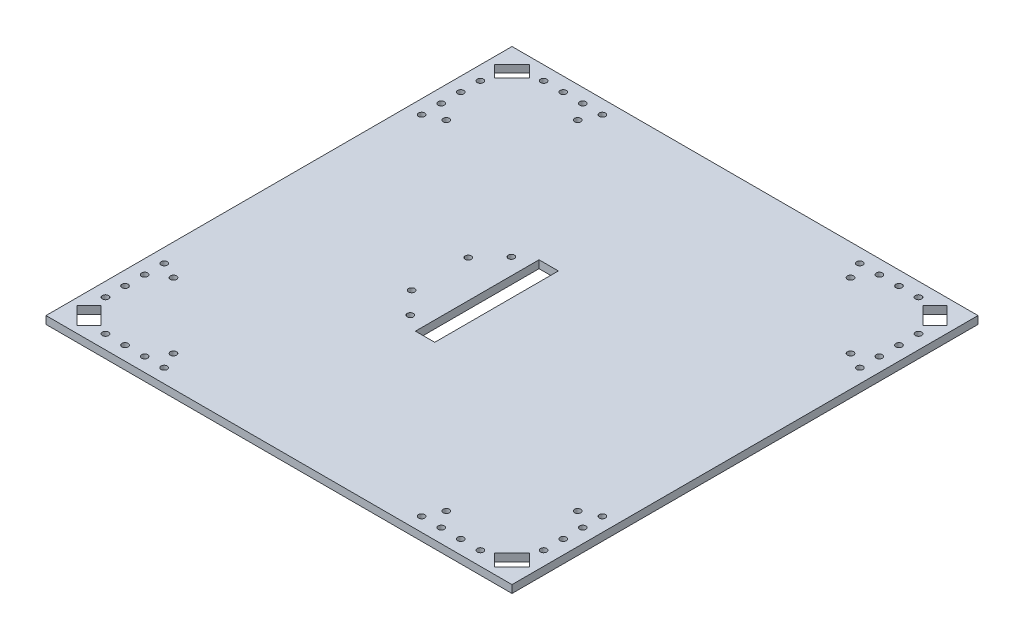
from build123d import *

# Parameters (mm, degrees)
SKETCH1_W               = 301.625
SKETCH1_H               = 301.625
BOSS_EXTRUDE1_DEPTH     = 5
CUT_EXTRUDE1_DEPTH      = 10
SKETCH4_W               = 12.5
SKETCH4_H               = 80
CUT_EXTRUDE3_DEPTH      = 214.33968293
SKETCH5_R               = 2
CUT_EXTRUDE4_DEPTH      = 10
MIRROR2_COPY_1_SKETCH_R = 2
MIRROR2_COPY_1_DEPTH    = 10
MIRROR3_COPY_1_SKETCH_R = 2
MIRROR3_COPY_1_DEPTH    = 10
MIRROR3_COPY_2_SKETCH_R = 2
MIRROR3_COPY_2_DEPTH    = 10
MIRROR3_COPY_3_SKETCH_R = 2
MIRROR3_COPY_3_DEPTH    = 10
SKETCH6_R               = 2
CUT_EXTRUDE5_DEPTH      = 214.33968293


with BuildPart() as part:
    # Sketch1 → Boss-Extrude1 (new body)
    with BuildSketch(Plane(origin=(0, 0, 0), x_dir=(1, 0, 0), z_dir=(0, 1, 0))):
        Rectangle(SKETCH1_W, SKETCH1_H)
    extrude(amount=BOSS_EXTRUDE1_DEPTH)

    # Sketch2 → Cut-Extrude1 (cut)
    with BuildSketch(Plane.XZ):
        Polygon((127.420616908, 138.734325407), (138.734325407, 127.420616908), (146.5125, 135.198791501), (135.198791501, 146.5125), align=None)
        Polygon((146.5125, -135.198791501), (138.734325407, -127.420616908), (127.420616908, -138.734325407), (135.198791501, -146.5125), align=None)
        Polygon((-135.198791501, -146.5125), (-127.420616908, -138.734325407), (-138.734325407, -127.420616908), (-146.5125, -135.198791501), align=None)
        Polygon((-146.5125, 135.198791501), (-138.734325407, 127.420616908), (-127.420616908, 138.734325407), (-135.198791501, 146.5125), align=None)
    extrude(amount=-CUT_EXTRUDE1_DEPTH, mode=Mode.SUBTRACT)

    # Sketch4 → Cut-Extrude3 (cut, through all)
    with BuildSketch(Plane(origin=(0, 5, 0), x_dir=(1, 0, 0), z_dir=(0, 1, 0))):
        with Locations((-16.25, 0)):
            Rectangle(SKETCH4_W, SKETCH4_H)
    extrude(amount=-CUT_EXTRUDE3_DEPTH, mode=Mode.SUBTRACT)

    # Sketch5 → Cut-Extrude4 (cut)
    with BuildSketch(Plane(origin=(0, 5, 0), x_dir=(1, 0, 0), z_dir=(0, 1, 0))):
        with Locations(Location((-130.8125, 88.3125, 0), (0, 0, 270))):
            Circle(SKETCH5_R)
        with Locations(Location((-141.8125, 95.979166667, 0), (0, 0, 270))):
            Circle(SKETCH5_R)
        with Locations(Location((-141.8125, 83.3125, 0), (0, 0, 270))):
            Circle(SKETCH5_R)
        with Locations(Location((-141.8125, 108.645833333, 0), (0, 0, 270))):
            Circle(SKETCH5_R)
        with Locations(Location((-141.8125, 121.3125, 0), (0, 0, 270))):
            Circle(SKETCH5_R)
    cut_extrude4 = extrude(amount=-CUT_EXTRUDE4_DEPTH, mode=Mode.SUBTRACT)

    # Mirror1: Cut-Extrude4 across plane
    add(cut_extrude4.mirror(Plane(origin=(0, 0, 0), x_dir=(0.7071067811865476, 0, 0.7071067811865476), z_dir=(-0.7071067811865477, 0, 0.7071067811865475))), mode=Mode.SUBTRACT)

    # Mirror2: Cut-Extrude4 across plane
    add(cut_extrude4.mirror(Plane.XY), mode=Mode.SUBTRACT)

    # Mirror2 copy 1 sketch → Mirror2 copy 1 (cut)
    with BuildSketch(Plane(origin=(0, 5, 0), x_dir=(0, 0, -1), z_dir=(0, 1, 0))):
        with Locations(Location((-130.8125, 88.3125, 0), (0, 0, 270))):
            Circle(MIRROR2_COPY_1_SKETCH_R)
        with Locations(Location((-141.8125, 95.979166667, 0), (0, 0, 270))):
            Circle(MIRROR2_COPY_1_SKETCH_R)
        with Locations(Location((-141.8125, 83.3125, 0), (0, 0, 270))):
            Circle(MIRROR2_COPY_1_SKETCH_R)
        with Locations(Location((-141.8125, 108.645833333, 0), (0, 0, 270))):
            Circle(MIRROR2_COPY_1_SKETCH_R)
        with Locations(Location((-141.8125, 121.3125, 0), (0, 0, 270))):
            Circle(MIRROR2_COPY_1_SKETCH_R)
    extrude(amount=-MIRROR2_COPY_1_DEPTH, mode=Mode.SUBTRACT)

    # Mirror3: Cut-Extrude4 across plane
    add(cut_extrude4.mirror(Plane(origin=(0, 0, 0), x_dir=(0, 0, 1), z_dir=(1, 0, 0))), mode=Mode.SUBTRACT)

    # Mirror3 copy 1 sketch → Mirror3 copy 1 (cut)
    with BuildSketch(Plane.ZX.offset(5)):
        with Locations(Location((-130.8125, 88.3125, 0), (0, 0, 270))):
            Circle(MIRROR3_COPY_1_SKETCH_R)
        with Locations(Location((-141.8125, 95.979166667, 0), (0, 0, 270))):
            Circle(MIRROR3_COPY_1_SKETCH_R)
        with Locations(Location((-141.8125, 83.3125, 0), (0, 0, 270))):
            Circle(MIRROR3_COPY_1_SKETCH_R)
        with Locations(Location((-141.8125, 108.645833333, 0), (0, 0, 270))):
            Circle(MIRROR3_COPY_1_SKETCH_R)
        with Locations(Location((-141.8125, 121.3125, 0), (0, 0, 270))):
            Circle(MIRROR3_COPY_1_SKETCH_R)
    extrude(amount=-MIRROR3_COPY_1_DEPTH, mode=Mode.SUBTRACT)

    # Mirror3 copy 2 sketch → Mirror3 copy 2 (cut)
    with BuildSketch(Plane(origin=(0, 5, 0), x_dir=(-1, 0, 0), z_dir=(0, 1, 0))):
        with Locations(Location((-130.8125, 88.3125, 0), (0, 0, 270))):
            Circle(MIRROR3_COPY_2_SKETCH_R)
        with Locations(Location((-141.8125, 95.979166667, 0), (0, 0, 270))):
            Circle(MIRROR3_COPY_2_SKETCH_R)
        with Locations(Location((-141.8125, 83.3125, 0), (0, 0, 270))):
            Circle(MIRROR3_COPY_2_SKETCH_R)
        with Locations(Location((-141.8125, 108.645833333, 0), (0, 0, 270))):
            Circle(MIRROR3_COPY_2_SKETCH_R)
        with Locations(Location((-141.8125, 121.3125, 0), (0, 0, 270))):
            Circle(MIRROR3_COPY_2_SKETCH_R)
    extrude(amount=-MIRROR3_COPY_2_DEPTH, mode=Mode.SUBTRACT)

    # Mirror3 copy 3 sketch → Mirror3 copy 3 (cut)
    with BuildSketch(Plane(origin=(0, 5, 0), x_dir=(0, 0, -1), z_dir=(0, 1, 0))):
        with Locations((-130.8125, -88.3125)):
            Circle(MIRROR3_COPY_3_SKETCH_R)
        with Locations((-141.8125, -95.979166667)):
            Circle(MIRROR3_COPY_3_SKETCH_R)
        with Locations((-141.8125, -83.3125)):
            Circle(MIRROR3_COPY_3_SKETCH_R)
        with Locations((-141.8125, -108.645833333)):
            Circle(MIRROR3_COPY_3_SKETCH_R)
        with Locations((-141.8125, -121.3125)):
            Circle(MIRROR3_COPY_3_SKETCH_R)
    extrude(amount=-MIRROR3_COPY_3_DEPTH, mode=Mode.SUBTRACT)

    # Sketch6 → Cut-Extrude5 (cut, through all)
    with BuildSketch(Plane(origin=(0, 5, 0), x_dir=(1, 0, 0), z_dir=(0, 1, 0))):
        with Locations(Location((-33.1225, -32.7, 0), (0, 0, 270))):
            Circle(SKETCH6_R)
        with Locations(Location((-46.6225, -18.3, 0), (0, 0, 270))):
            Circle(SKETCH6_R)
        with Locations(Location((-46.6225, 18.3, 0), (0, 0, 270))):
            Circle(SKETCH6_R)
        with Locations(Location((-33.1225, 32.7, 0), (0, 0, 270))):
            Circle(SKETCH6_R)
    extrude(amount=-CUT_EXTRUDE5_DEPTH, mode=Mode.SUBTRACT)


solid = part.part
